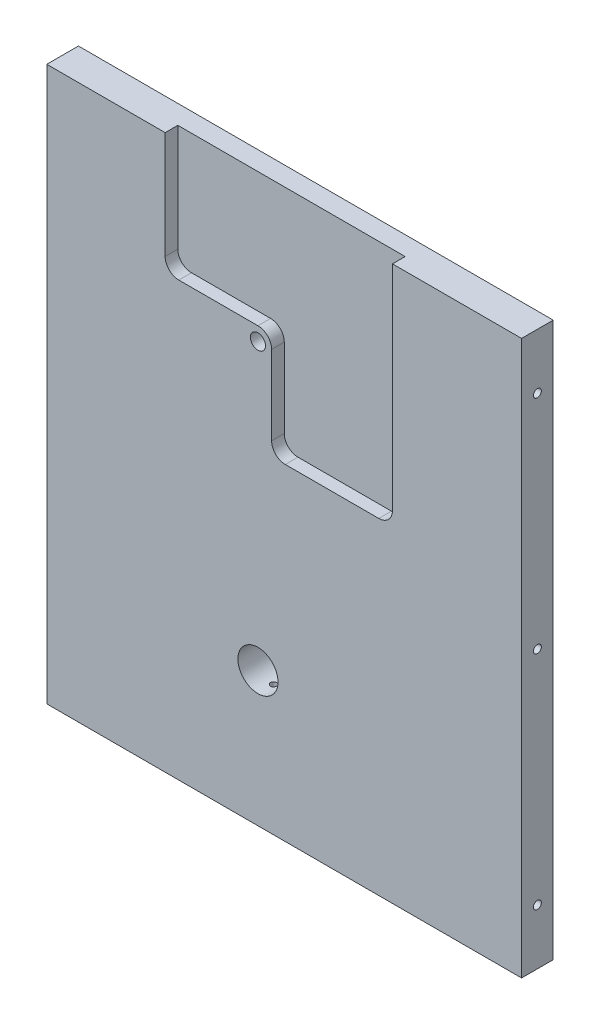
from build123d import *

# Parameters (mm, degrees)
SKIZZE1_W                       = 150
SKIZZE1_H                       = 175
AUFSATZ_LINEAR_AUSTRAGEN1_DEPTH = 10
SKIZZE2_R                       = 2.3876
SKIZZE2_R_2                     = 6.335
SCHNITT_LINEAR_AUSTRAGEN1_DEPTH = 10
SCHNITT_LINEAR_AUSTRAGEN2_DEPTH = 4
SKIZZE4_R                       = 1.25
SCHNITT_LINEAR_AUSTRAGEN3_DEPTH = 5
SCHNITT_LINEAR_START            = -5
SKIZZE6_R                       = 1.25
SCHNITT_LINEAR_AUSTRAGEN4_DEPTH = 5
SKIZZE7_R                       = 1
SCHNITT_LINEAR_AUSTRAGEN5_DEPTH = 40


with BuildPart() as part:
    # Skizze1 → Aufsatz-Linear austragen1 (new body)
    with BuildSketch(Plane.XY):
        with Locations((-21.140947697, -18.099765847)):
            Rectangle(SKIZZE1_W, SKIZZE1_H)
    extrude(amount=AUFSATZ_LINEAR_AUSTRAGEN1_DEPTH)

    # Skizze2 → Schnitt-Linear austragen1 (cut)
    with BuildSketch(Plane.XY.offset(10)):
        with Locations((-29.425704113, 26.900234153)):
            Circle(SKIZZE2_R)
        with Locations((-29.425704113, -63.099765847)):
            Circle(SKIZZE2_R_2)
    extrude(amount=-SCHNITT_LINEAR_AUSTRAGEN1_DEPTH, mode=Mode.SUBTRACT)

    # Skizze3 → Schnitt-Linear austragen2 (cut)
    with BuildSketch(Plane.XY.offset(10)):
        with BuildLine():
            Line((-54.425704113, 31.218234153), (-29.425704113, 31.218234153))
            ThreePointArc((-29.425704113, 31.218234153), (-26.372417032, 29.953521235), (-25.107704113, 26.900234153))
            Line((-25.107704113, 26.900234153), (-25.107704113, 1.900234153))
            ThreePointArc((-25.107704113, 1.900234153), (-23.842991195, -1.153052928), (-20.789704113, -2.417765847))
            Line((-20.789704113, -2.417765847), (8.756295887, -2.417765847))
            ThreePointArc((8.756295887, -2.417765847), (11.809582968, -1.153052928), (13.074295887, 1.900234153))
            Line((13.074295887, 1.900234153), (13.074295887, 69.400234153))
            Line((13.074295887, 69.400234153), (-58.743704113, 69.400234153))
            Line((-58.743704113, 69.400234153), (-58.743704113, 35.536234153))
            ThreePointArc((-58.743704113, 35.536234153), (-57.478991195, 32.482947072), (-54.425704113, 31.218234153))
        make_face()
    extrude(amount=-SCHNITT_LINEAR_AUSTRAGEN2_DEPTH, mode=Mode.SUBTRACT)

    # Skizze4 → Schnitt-Linear austragen3 (cut)
    with BuildSketch(Plane.ZY.offset(96.140947697)):
        with Locations(Location((5, 51.900234153, 0), (0, 0, 270))):
            Circle(SKIZZE4_R)
        with Locations(Location((5, -18.099765847, 0), (0, 0, 270))):
            Circle(SKIZZE4_R)
        with Locations(Location((5, -88.099765847, 0), (0, 0, 270))):
            Circle(SKIZZE4_R)
    extrude(amount=-SCHNITT_LINEAR_AUSTRAGEN3_DEPTH, mode=Mode.SUBTRACT)

    # Skizze6 → Schnitt-Linear austragen4 (cut)
    with BuildSketch(Plane(origin=(53.859052303, 0, 0), x_dir=(0, 0, -1), z_dir=(1, 0, 0)).offset(SCHNITT_LINEAR_START)):
        with Locations(Location((-5, 51.900234153, 0), (0, 0, 270))):
            Circle(SKIZZE6_R)
        with Locations(Location((-5, -18.099765847, 0), (0, 0, 270))):
            Circle(SKIZZE6_R)
        with Locations(Location((-5, -88.099765847, 0), (0, 0, 270))):
            Circle(SKIZZE6_R)
    extrude(amount=SCHNITT_LINEAR_AUSTRAGEN4_DEPTH, mode=Mode.SUBTRACT)

    # Skizze7 → Schnitt-Linear austragen5 (cut)
    with BuildSketch(Plane.XZ.offset(105.599765847)):
        with Locations(Location((-29.420947697, 5, 0), (0, 0, 270))):
            Circle(SKIZZE7_R)
    extrude(amount=-SCHNITT_LINEAR_AUSTRAGEN5_DEPTH, mode=Mode.SUBTRACT)


solid = part.part
